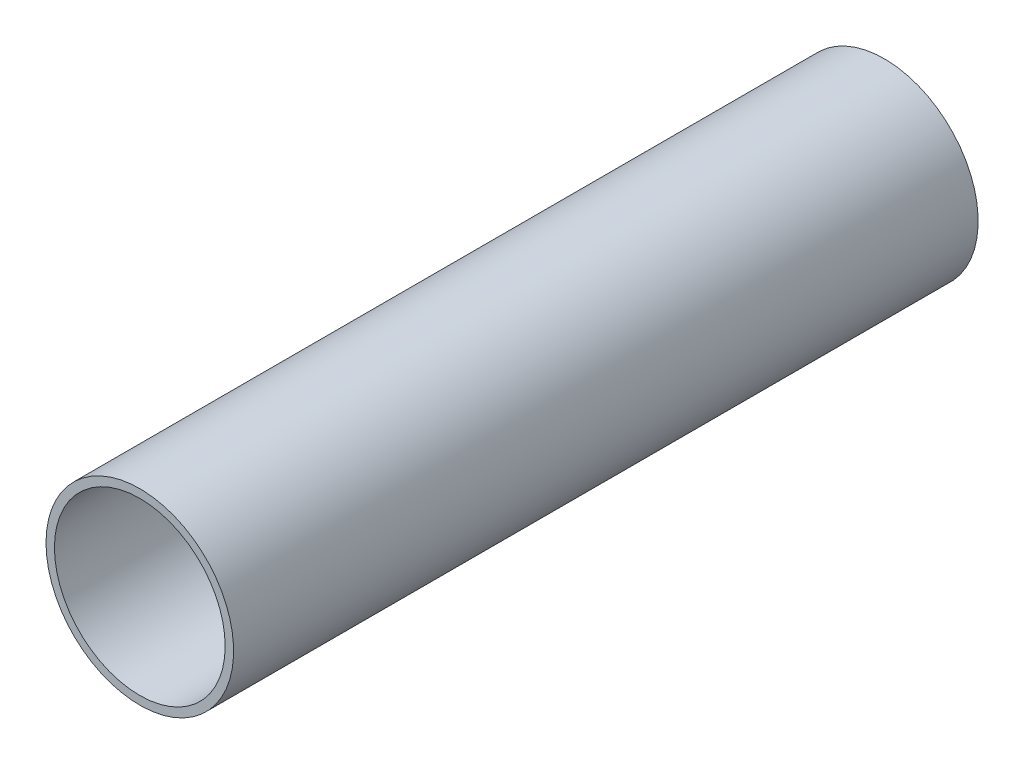
from build123d import *

# Parameters (mm, degrees)
SKETCH1_R           = 19.2
SKETCH1_R_2         = 17.475
BOSS_EXTRUDE1_DEPTH = 152.4


with BuildPart() as part:
    # Sketch1 → Boss-Extrude1 (new body)
    with BuildSketch(Plane.XY):
        with Locations(Location((0, 0, 0), (0, 0, 180))):
            Circle(SKETCH1_R)
        with Locations(Location((0, 0, 0), (0, 0, 180))):
            Circle(SKETCH1_R_2, mode=Mode.SUBTRACT)
    extrude(amount=BOSS_EXTRUDE1_DEPTH)


solid = part.part
